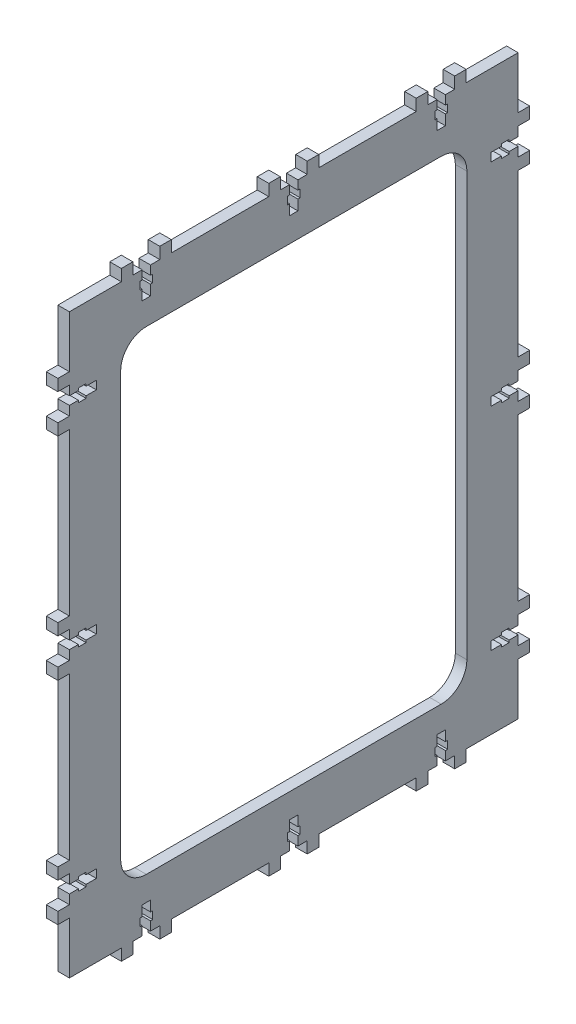
from build123d import *

# Parameters (mm, degrees)
BOSS_EXTRUDE1_DEPTH = 9


with BuildPart() as part:
    # Sketch1 → Boss-Extrude1 (new body)
    with BuildSketch(Plane(origin=(0, 0, 0), x_dir=(0, 0, -1), z_dir=(1, 0, 0))):
        Polygon((-175, -225), (-134.5, -225), (-134.5, -234), (-125.5, -234), (-125.5, -225), (-118.25, -225), (-118.25, -218), (-119.975, -218), (-119.975, -212), (-118.25, -212), (-118.25, -204), (-111.75, -204), (-111.75, -212), (-110.025, -212), (-110.025, -218), (-111.75, -218), (-111.75, -225), (-104.5, -225), (-104.5, -234), (-95.5, -234), (-95.5, -225), (-19.5, -225), (-19.5, -234), (-10.5, -234), (-10.5, -225), (-3.25, -225), (-3.25, -218), (-4.975, -218), (-4.975, -212), (-3.25, -212), (-3.25, -204), (3.25, -204), (3.25, -212), (4.975, -212), (4.975, -218), (3.25, -218), (3.25, -225), (10.5, -225), (10.5, -234), (19.5, -234), (19.5, -225), (95.5, -225), (95.5, -234), (104.5, -234), (104.5, -225), (111.75, -225), (111.75, -218), (110.025, -218), (110.025, -212), (111.75, -212), (111.75, -204), (118.25, -204), (118.25, -212), (119.975, -212), (119.975, -218), (118.25, -218), (118.25, -225), (125.5, -225), (125.5, -234), (134.5, -234), (134.5, -225), (175, -225), (175, -184.5), (184, -184.5), (184, -175.5), (175, -175.5), (175, -168.25), (168, -168.25), (168, -169.975), (162, -169.975), (162, -168.25), (154, -168.25), (154, -161.75), (162, -161.75), (162, -160.025), (168, -160.025), (168, -161.75), (175, -161.75), (175, -154.5), (184, -154.5), (184, -145.5), (175, -145.5), (175, -19.5), (184, -19.5), (184, -10.5), (175, -10.5), (175, -3.25), (168, -3.25), (168, -4.975), (162, -4.975), (162, -3.25), (154, -3.25), (154, 3.25), (162, 3.25), (162, 4.975), (168, 4.975), (168, 3.25), (175, 3.25), (175, 10.5), (184, 10.5), (184, 19.5), (175, 19.5), (175, 145.5), (184, 145.5), (184, 154.5), (175, 154.5), (175, 161.75), (168, 161.75), (168, 160.025), (162, 160.025), (162, 161.75), (154, 161.75), (154, 168.25), (162, 168.25), (162, 169.975), (168, 169.975), (168, 168.25), (175, 168.25), (175, 175.5), (184, 175.5), (184, 184.5), (175, 184.5), (175, 225), (134.5, 225), (134.5, 234), (125.5, 234), (125.5, 225), (118.25, 225), (118.25, 218), (119.975, 218), (119.975, 212), (118.25, 212), (118.25, 204), (111.75, 204), (111.75, 212), (110.025, 212), (110.025, 218), (111.75, 218), (111.75, 225), (104.5, 225), (104.5, 234), (95.5, 234), (95.5, 225), (19.5, 225), (19.5, 234), (10.5, 234), (10.5, 225), (3.25, 225), (3.25, 218), (4.975, 218), (4.975, 212), (3.25, 212), (3.25, 204), (-3.25, 204), (-3.25, 212), (-4.975, 212), (-4.975, 218), (-3.25, 218), (-3.25, 225), (-10.5, 225), (-10.5, 234), (-19.5, 234), (-19.5, 225), (-95.5, 225), (-95.5, 234), (-104.5, 234), (-104.5, 225), (-111.75, 225), (-111.75, 218), (-110.025, 218), (-110.025, 212), (-111.75, 212), (-111.75, 204), (-118.25, 204), (-118.25, 212), (-119.975, 212), (-119.975, 218), (-118.25, 218), (-118.25, 225), (-125.5, 225), (-125.5, 234), (-134.5, 234), (-134.5, 225), (-175, 225), (-175, 184.5), (-184, 184.5), (-184, 175.5), (-175, 175.5), (-175, 168.25), (-168, 168.25), (-168, 169.975), (-162, 169.975), (-162, 168.25), (-154, 168.25), (-154, 161.75), (-162, 161.75), (-162, 160.025), (-168, 160.025), (-168, 161.75), (-175, 161.75), (-175, 154.5), (-184, 154.5), (-184, 145.5), (-175, 145.5), (-175, 19.5), (-184, 19.5), (-184, 10.5), (-175, 10.5), (-175, 3.25), (-168, 3.25), (-168, 4.975), (-162, 4.975), (-162, 3.25), (-154, 3.25), (-154, -3.25), (-162, -3.25), (-162, -4.975), (-168, -4.975), (-168, -3.25), (-175, -3.25), (-175, -10.5), (-184, -10.5), (-184, -19.5), (-175, -19.5), (-175, -145.5), (-184, -145.5), (-184, -154.5), (-175, -154.5), (-175, -161.75), (-168, -161.75), (-168, -160.025), (-162, -160.025), (-162, -161.75), (-154, -161.75), (-154, -168.25), (-162, -168.25), (-162, -169.975), (-168, -169.975), (-168, -168.25), (-175, -168.25), (-175, -175.5), (-184, -175.5), (-184, -184.5), (-175, -184.5), align=None)
        with BuildLine():
            Line((115, -185), (-115, -185))
            ThreePointArc((-115, -185), (-129.142135624, -179.142135624), (-135, -165))
            Line((-135, -165), (-135, 165))
            ThreePointArc((-135, 165), (-129.142135624, 179.142135624), (-115, 185))
            Line((-115, 185), (115, 185))
            ThreePointArc((115, 185), (129.142135624, 179.142135624), (135, 165))
            Line((135, 165), (135, -165))
            ThreePointArc((135, -165), (129.142135624, -179.142135624), (115, -185))
        make_face(mode=Mode.SUBTRACT)
    extrude(amount=BOSS_EXTRUDE1_DEPTH)


solid = part.part
